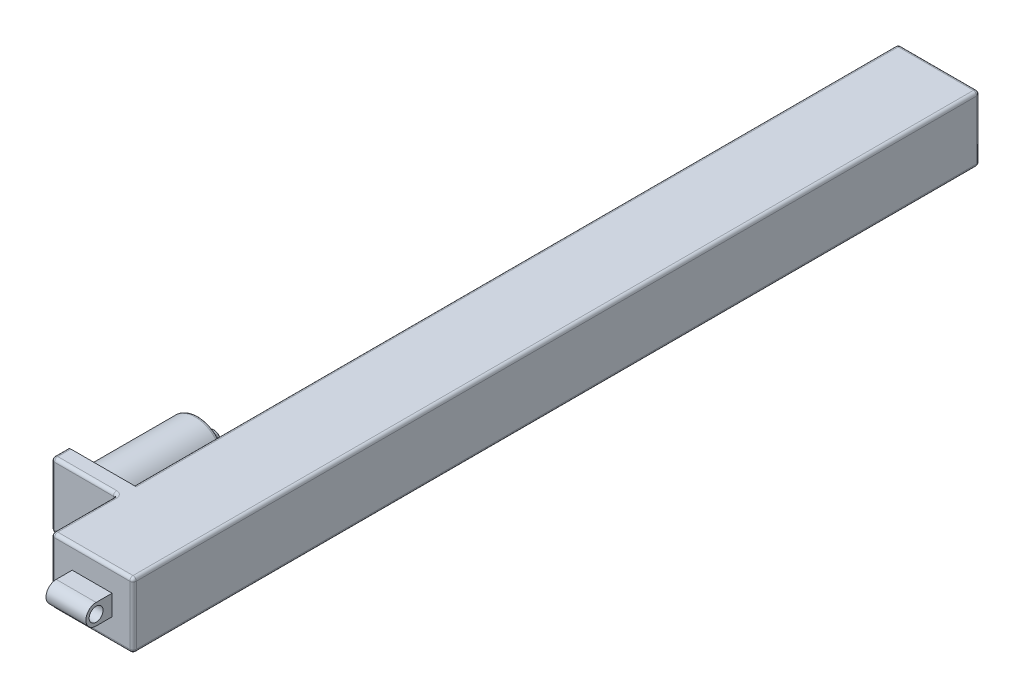
from build123d import *

# Parameters (mm, degrees)
SKETCH1_W                       = 25
SKETCH1_H                       = 20
SKETCH1_R                       = 4
BOSS_EXTRUDE1_DEPTH             = 254
SKETCH2_W                       = 25
SKETCH2_H                       = 20
BOSS_EXTRUDE2_DEPTH             = 5
BOSS_EXTRUDE3_REACH             = 261.494
SKETCH6_R                       = 2.125
BOSS_EXTRUDE3_DIRECTION_2_REACH = 261.494
SKETCH7_W                       = 5
SKETCH7_H                       = 20
BOSS_EXTRUDE4_DEPTH             = 20
SKETCH8_R                       = 8.5
BOSS_EXTRUDE5_DEPTH             = 30
SKETCH9_R                       = 2.5
BOSS_EXTRUDE6_DEPTH             = 5
FILLET1_R                       = 1
FILLET2_R                       = 1
CUT_EXTRUDE1_DEPTH              = 10


with BuildPart() as part:
    # Sketch1 → Boss-Extrude1 (new body)
    with BuildSketch(Plane.XY):
        Rectangle(SKETCH1_W, SKETCH1_H)
        Circle(SKETCH1_R, mode=Mode.SUBTRACT)
    extrude(amount=BOSS_EXTRUDE1_DEPTH)

    # Sketch2 → Boss-Extrude2 (add)
    with BuildSketch(Plane.XY.offset(254)):
        Rectangle(SKETCH2_W, SKETCH2_H)
    extrude(amount=BOSS_EXTRUDE2_DEPTH)

    # Boss-Extrude3: up to this face of the body (flat: up to its plane)
    boss_extrude3_end = Plane(part.part.faces().sort_by_distance((12.5, 0, 129.5))[0])
    # Sketch6 → Boss-Extrude3 (add, up to the picked face)
    with BuildSketch(Plane(origin=(0, 0, 0), x_dir=(0, 0, -1), z_dir=(1, 0, 0)), mode=Mode.PRIVATE) as boss_extrude3_sk1:
        with BuildLine():
            Line((-259, -3.125), (-259, 3.125))
            Line((-259, 3.125), (-263.8892053, 3.125))
            ThreePointArc((-263.8892053, 3.125), (-267.0142053, 0), (-263.8892053, -3.125))
            Line((-263.8892053, -3.125), (-259, -3.125))
        make_face()
        with Locations(Location((-263.8892053, 0, 0), (0, 0, 180))):
            Circle(SKETCH6_R, mode=Mode.SUBTRACT)
    boss_extrude3_tool1 = split(extrude(boss_extrude3_sk1.sketch, amount=BOSS_EXTRUDE3_REACH, mode=Mode.PRIVATE), bisect_by=boss_extrude3_end, keep=Keep.BOTH, mode=Mode.PRIVATE)
    add(boss_extrude3_tool1.solids().sort_by(Axis((0, -3.023368, 261.444603), (1, 0, 0)))[0])

    # Boss-Extrude3 direction 2: up to this face of the body (flat: up to its plane)
    boss_extrude3_direction_2_end = Plane(part.part.faces().sort_by_distance((-12.5, 0, 129.5))[0])
    # Sketch6 → Boss-Extrude3 direction 2 (add, up to the picked face)
    with BuildSketch(Plane(origin=(0, 0, 0), x_dir=(0, 0, -1), z_dir=(1, 0, 0)), mode=Mode.PRIVATE) as boss_extrude3_direction_2_sk1:
        with BuildLine():
            Line((-259, -3.125), (-259, 3.125))
            Line((-259, 3.125), (-263.8892053, 3.125))
            ThreePointArc((-263.8892053, 3.125), (-267.0142053, 0), (-263.8892053, -3.125))
            Line((-263.8892053, -3.125), (-259, -3.125))
        make_face()
        with Locations(Location((-263.8892053, 0, 0), (0, 0, 180))):
            Circle(SKETCH6_R, mode=Mode.SUBTRACT)
    boss_extrude3_direction_2_tool1 = split(extrude(boss_extrude3_direction_2_sk1.sketch, amount=-BOSS_EXTRUDE3_DIRECTION_2_REACH, mode=Mode.PRIVATE), bisect_by=boss_extrude3_direction_2_end, keep=Keep.BOTH, mode=Mode.PRIVATE)
    add(boss_extrude3_direction_2_tool1.solids().sort_by(Axis((0, -3.023368, 261.444603), (-1, 0, 0)))[0])

    # Sketch7 → Boss-Extrude4 (add)
    with BuildSketch(Plane.ZY.offset(12.5)):
        with Locations((236.5, 0)):
            Rectangle(SKETCH7_W, SKETCH7_H)
    extrude(amount=BOSS_EXTRUDE4_DEPTH)

    # Sketch8 → Boss-Extrude5 (add)
    with BuildSketch(Plane(origin=(0, 0, 234), x_dir=(-1, 0, 0), z_dir=(0, 0, -1))):
        with Locations(Location((22.5, 0, 0), (0, 0, 180))):
            Circle(SKETCH8_R)
    extrude(amount=BOSS_EXTRUDE5_DEPTH)

    # Sketch9 → Boss-Extrude6 (add)
    with BuildSketch(Plane(origin=(0, 0, 204), x_dir=(-1, 0, 0), z_dir=(0, 0, -1))):
        with Locations((22.5, 0)):
            Circle(SKETCH9_R)
    extrude(amount=BOSS_EXTRUDE6_DEPTH)

    # Fillet1
    fillet1_edges = [part.edges().sort_by_distance(p)[0] for p in [
        (-22.5, 10, 239),
        (-32.5, 0, 239),
        (-22.5, -10, 239),
        (-32.5, 10, 236.5),
        (-32.5, -10, 236.5),
        (-12.5, 0, 239),
        (-31, 0, 234),
        (-31, 0, 204),
        (-20, 0, 204),
        (-20, 0, 199),
        (-12.5, -10, 249),
        (-12.5, 10, 249),
    ]]
    fillet(fillet1_edges, radius=FILLET1_R)

    # Fillet2
    fillet2_edges = [part.edges().sort_by_distance(p)[0] for p in [
        (-4, 0, 0),
        (12.5, -6.5625, 259),
        (0.5, 10, 259),
        (12.5, 6.5625, 259),
        (-12.5, -6.0625, 259),
        (0, -10, 0),
        (-12.5, 0, 0),
        (-12.5, -10, 117),
        (-12.5, 10, 117),
        (0, 10, 0),
        (12.5, 0, 0),
        (12.5, -10, 129.5),
        (0.5, -10, 259),
        (12.5, 10, 129.5),
        (-12.5, 6.0625, 259),
        (-12.207106781, -9.707106781, 259),
        (-12.207106781, 9.707106781, 259),
    ]]
    fillet(fillet2_edges, radius=FILLET2_R)

    # Sketch10 → Cut-Extrude1 (cut)
    with BuildSketch(Plane.XZ.offset(3.125)):
        with BuildLine():
            Line((-6.1, 273.993872031), (-12.920105656, 273.993872031))
            Line((-12.920105656, 273.993872031), (-12.920105656, 258.123960948))
            Line((-12.920105656, 258.123960948), (-12.5, 258))
            ThreePointArc((-12.5, 258), (-12.207106781, 258.707106781), (-11.5, 259))
            Line((-11.5, 259), (-6.1, 259))
            Line((-6.1, 259), (-6.1, 273.993872031))
        make_face()
        with BuildLine():
            Line((11.5, 259), (6.1, 259))
            Line((6.1, 259), (6.1, 273.993872031))
            Line((6.1, 273.993872031), (12.920105656, 273.993872031))
            Line((12.920105656, 273.993872031), (12.920105656, 258.123960948))
            Line((12.920105656, 258.123960948), (12.5, 258))
            ThreePointArc((12.5, 258), (12.207106781, 258.707106781), (11.5, 259))
        make_face()
    extrude(amount=-CUT_EXTRUDE1_DEPTH, mode=Mode.SUBTRACT)


solid = part.part
